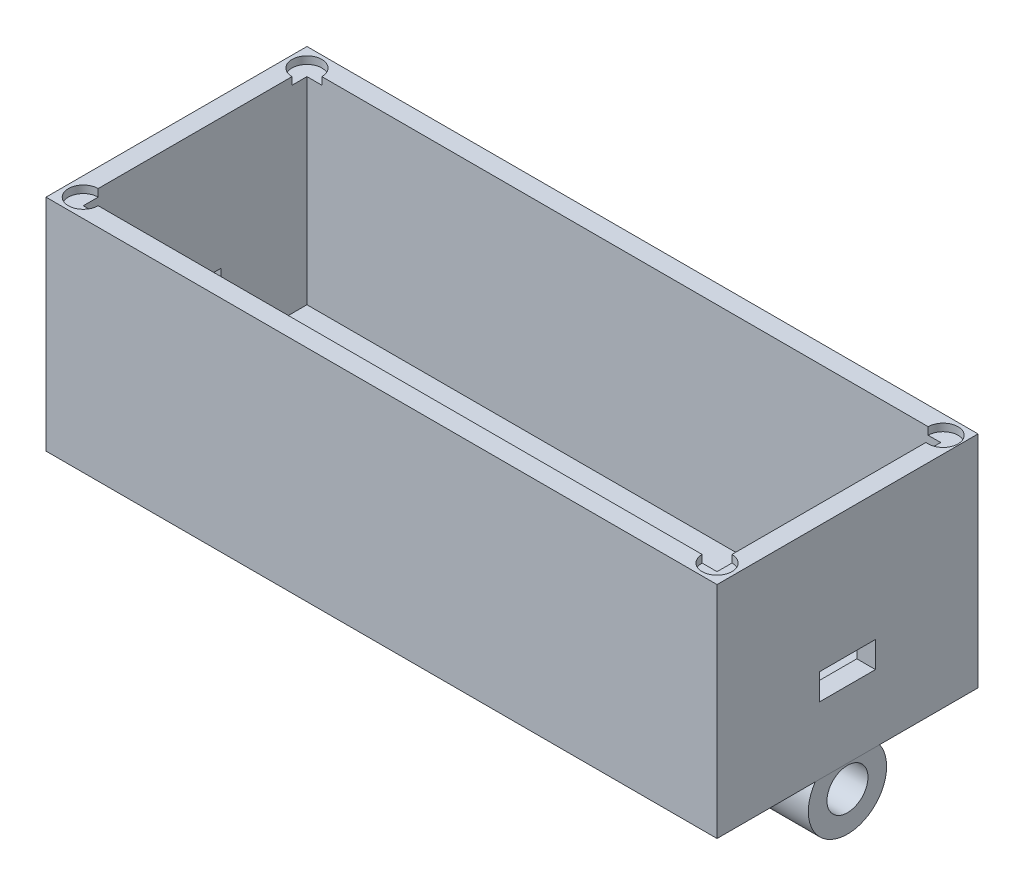
from build123d import *

# Parameters (mm, degrees)
SKETCH2_R           = 10.5
SKETCH2_R_2         = 5.5
BOSS_EXTRUDE1_DEPTH = 180
SKETCH6_W           = 180
SKETCH6_H           = 70
BOSS_EXTRUDE2_DEPTH = 4
SKETCH8_W           = 180
SKETCH8_H           = 70
SKETCH8_W_2         = 170
SKETCH8_H_2         = 60
BOSS_EXTRUDE3_DEPTH = 55
SKETCH9_W           = 15
SKETCH9_H           = 7
CUT_EXTRUDE1_DEPTH  = 5
SKETCH10_W          = 14
SKETCH10_H          = 8
CUT_EXTRUDE2_DEPTH  = 5
SKETCH11_R          = 4
CUT_EXTRUDE3_DEPTH  = 2


with BuildPart() as part:
    # Sketch2 → Boss-Extrude1 (new body)
    with BuildSketch(Plane(origin=(0, 0, 0), x_dir=(0, 0, -1), z_dir=(1, 0, 0))):
        with Locations(Location((0, 0, 0), (0, 0, 180))):
            Circle(SKETCH2_R)
        with Locations(Location((0, 0, 0), (0, 0, 180))):
            Circle(SKETCH2_R_2, mode=Mode.SUBTRACT)
    extrude(amount=BOSS_EXTRUDE1_DEPTH)

    # Sketch6 → Boss-Extrude2 (add)
    with BuildSketch(Plane(origin=(0, 10, 0), x_dir=(1, 0, 0), z_dir=(0, 1, 0))):
        with Locations((90.013629188, 0)):
            Rectangle(SKETCH6_W, SKETCH6_H)
    extrude(amount=-BOSS_EXTRUDE2_DEPTH)

    # Sketch8 → Boss-Extrude3 (add)
    with BuildSketch(Plane(origin=(0, 10, 0), x_dir=(1, 0, 0), z_dir=(0, 1, 0))):
        with Locations((90.013629188, 0)):
            Rectangle(SKETCH8_W, SKETCH8_H)
        with Locations((90.013629188, 0)):
            Rectangle(SKETCH8_W_2, SKETCH8_H_2, mode=Mode.SUBTRACT)
    extrude(amount=BOSS_EXTRUDE3_DEPTH)

    # Sketch9 → Cut-Extrude1 (cut)
    with BuildSketch(Plane(origin=(180.013629188, 0, 0), x_dir=(0, 0, -1), z_dir=(1, 0, 0))):
        with Locations((0, 27.5)):
            Rectangle(SKETCH9_W, SKETCH9_H)
    extrude(amount=-CUT_EXTRUDE1_DEPTH, mode=Mode.SUBTRACT)

    # Sketch10 → Cut-Extrude2 (cut)
    with BuildSketch(Plane.ZY.offset(-0.013629188)):
        with Locations((0, 26)):
            Rectangle(SKETCH10_W, SKETCH10_H)
    extrude(amount=-CUT_EXTRUDE2_DEPTH, mode=Mode.SUBTRACT)

    # Sketch11 → Cut-Extrude3 (cut)
    with BuildSketch(Plane(origin=(0, 65, 0), x_dir=(1, 0, 0), z_dir=(0, 1, 0))):
        with Locations((5.013629188, 30)):
            Circle(SKETCH11_R)
        with Locations((175.656317999, 30)):
            Circle(SKETCH11_R)
        with Locations((5.013629188, -30)):
            Circle(SKETCH11_R)
        with Locations((175.013629188, -30)):
            Circle(SKETCH11_R)
    extrude(amount=-CUT_EXTRUDE3_DEPTH, mode=Mode.SUBTRACT)


solid = part.part
